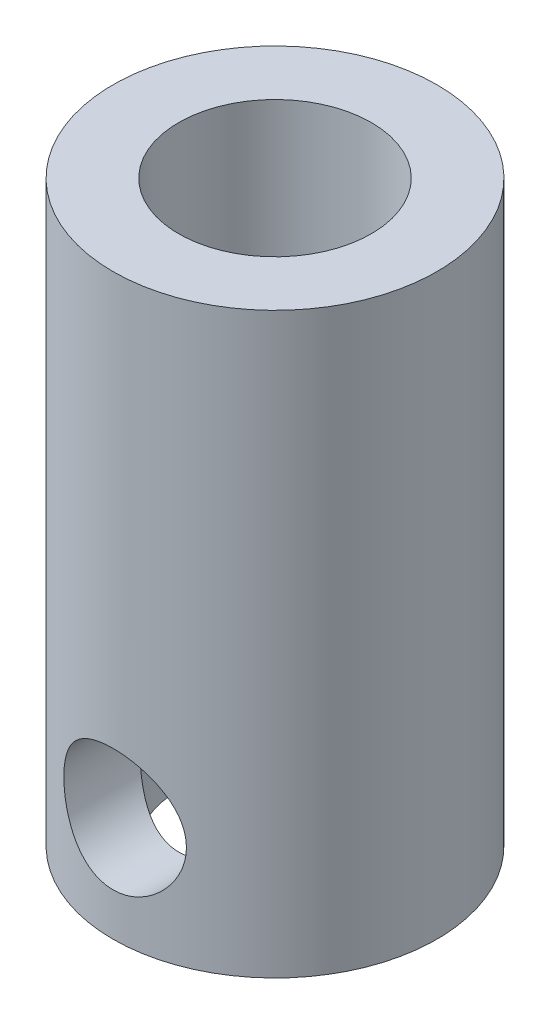
from build123d import *

# Parameters (mm, degrees)
SKETCH1_W                        = 5.334
SKETCH1_H                        = 19.05
F_1_4_0_25_DIAMETER_HOLE1_D      = 6.35
F_21_0_159_DIAMETER_HOLE1_REACH  = 21.654
F_21_0_159_DIAMETER_HOLE1_BORE_R = 2.0193


with BuildPart() as part:
    # Sketch1 → Revolve1 (revolve)
    with BuildSketch(Plane.XY, mode=Mode.PRIVATE) as revolve1_sk:
        with Locations((2.667, 9.525)):
            Rectangle(SKETCH1_W, SKETCH1_H)
    revolve(revolve1_sk.sketch.rotate(Axis((0, 19.05, 0), (0, -1, 0)), 270), axis=Axis((0, 19.05, 0), (0, -1, 0)))

    # 1/4 (0.25) Diameter Hole1 (through all)
    with Locations(Plane(origin=(0, 0, 0), x_dir=(-1, 0, 0), z_dir=(0, -1, 0))):
        with Locations((0, 0)):
            Hole(F_1_4_0_25_DIAMETER_HOLE1_D / 2)

    # #21 (0.159) Diameter Hole1 bore (on position points) → #21 (0.159) Diameter Hole1 (cut, up to next)
    with BuildSketch(Plane(origin=(0, 3.429, 5.334), x_dir=(1, 0, 0), z_dir=(0, 0, 1)), mode=Mode.PRIVATE) as f_21_0_159_diameter_hole1_sk1:
        Circle(F_21_0_159_DIAMETER_HOLE1_BORE_R)
    f_21_0_159_diameter_hole1_tool1 = extrude(f_21_0_159_diameter_hole1_sk1.sketch, amount=-F_21_0_159_DIAMETER_HOLE1_REACH, mode=Mode.PRIVATE) & part.part
    add(f_21_0_159_diameter_hole1_tool1.solids().sort_by_distance((0, 3.429, 5.334))[0], mode=Mode.SUBTRACT)


solid = part.part
